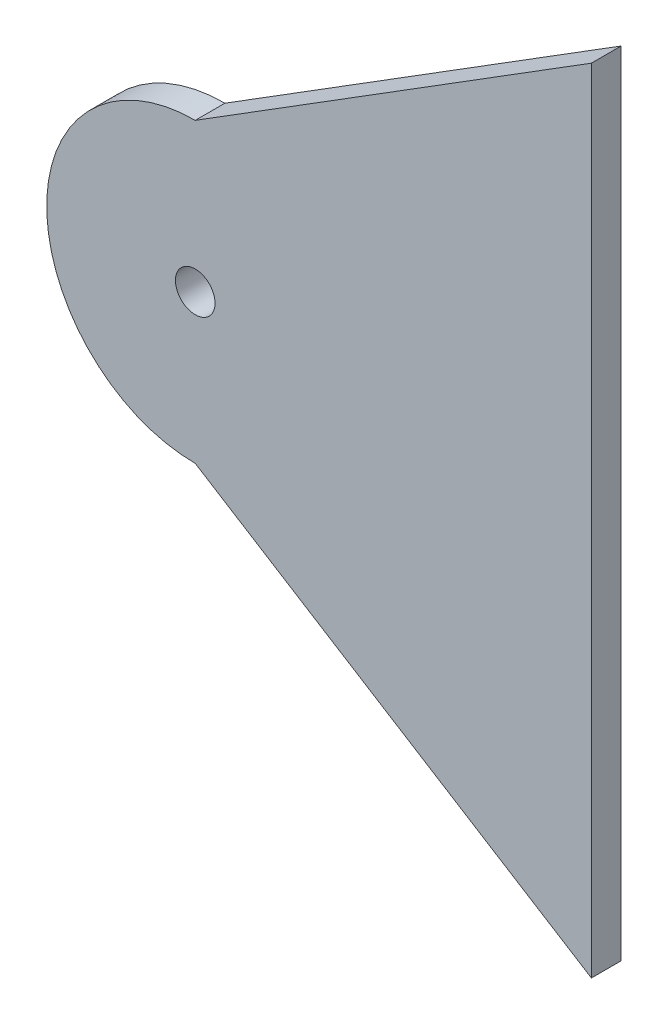
from build123d import *

# Parameters (mm, degrees)
SKETCH_1_R      = 2
EXTRUDE_1_DEPTH = 3


with BuildPart() as part:
    # 草图1 → 凸台-拉伸1 (new body)
    with BuildSketch(Plane.XY):
        with BuildLine():
            Line((254.002581869, 28.707860978), (294.002581869, 53.707860978))
            Line((294.002581869, 53.707860978), (294.002581869, 13.707860978))
            Line((294.002581869, 13.707860978), (294.002581869, -26.292139022))
            Line((294.002581869, -26.292139022), (254.002581869, -1.292139022))
            ThreePointArc((254.002581869, -1.292139022), (239.002581869, 13.707860978), (254.002581869, 28.707860978))
        make_face()
        with Locations((254.002581869, 13.707860978)):
            Circle(SKETCH_1_R, mode=Mode.SUBTRACT)
    extrude(amount=EXTRUDE_1_DEPTH)


solid = part.part
